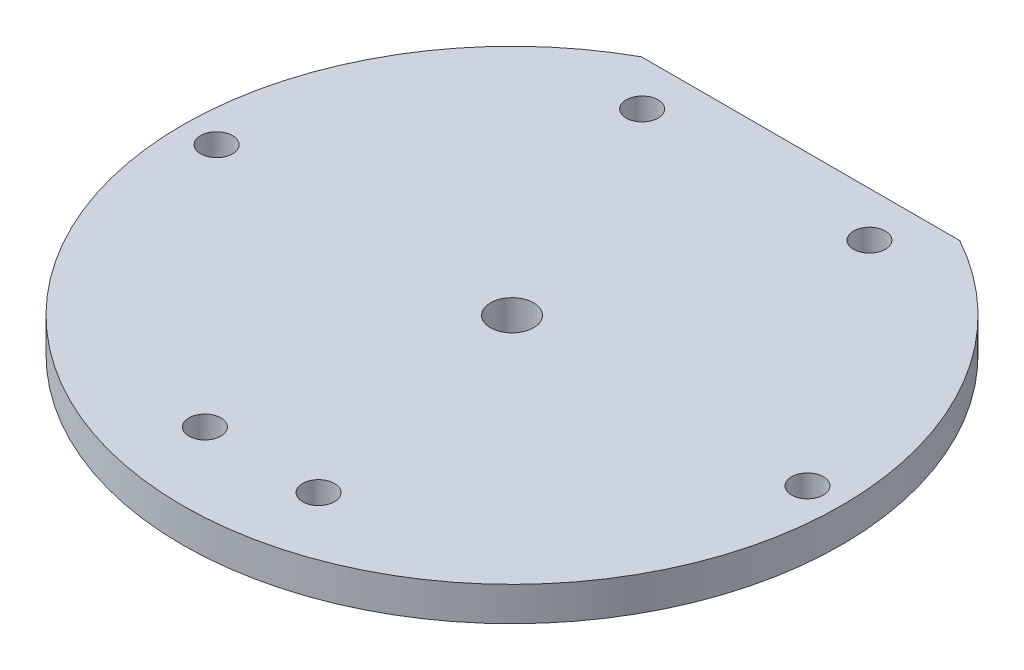
from build123d import *

# Parameters (mm, degrees)
SKETCH1_R           = 29
BOSS_EXTRUDE1_DEPTH = 3
SKETCH3_R           = 4
BOSS_EXTRUDE2_DEPTH = 4
SKETCH2_R           = 1.9
CUT_EXTRUDE1_DEPTH  = 42.605288125
SKETCH6_R           = 1.4
CUT_EXTRUDE3_DEPTH  = 10
SKETCH7_R           = 1.4
CUT_EXTRUDE4_DEPTH  = 10
CUT_EXTRUDE5_START  = -10
CUT_EXTRUDE5_DEPTH  = 10
SKETCH4_R           = 1.4
CUT_EXTRUDE7_DEPTH  = 10


with BuildPart() as part:
    # Sketch1 → Boss-Extrude1 (new body)
    with BuildSketch(Plane(origin=(0, 0, 0), x_dir=(1, 0, 0), z_dir=(0, 1, 0))):
        Circle(SKETCH1_R)
    extrude(amount=BOSS_EXTRUDE1_DEPTH)

    # Sketch3 → Boss-Extrude2 (add)
    with BuildSketch(Plane.XZ):
        Circle(SKETCH3_R)
    extrude(amount=BOSS_EXTRUDE2_DEPTH)

    # Sketch2 → Cut-Extrude1 (cut, through all)
    with BuildSketch(Plane(origin=(0, 3, 0), x_dir=(1, 0, 0), z_dir=(0, 1, 0))):
        Circle(SKETCH2_R)
    extrude(amount=-CUT_EXTRUDE1_DEPTH, mode=Mode.SUBTRACT)

    # Sketch6 → Cut-Extrude3 (cut)
    with BuildSketch(Plane(origin=(0, 3, 0), x_dir=(1, 0, 0), z_dir=(0, 1, 0))):
        with Locations((26, 0)):
            Circle(SKETCH6_R)
        with Locations((-26, 0)):
            Circle(SKETCH6_R)
    extrude(amount=-CUT_EXTRUDE3_DEPTH, mode=Mode.SUBTRACT)

    # Sketch7 → Cut-Extrude4 (cut)
    with BuildSketch(Plane(origin=(0, 3, 0), x_dir=(1, 0, 0), z_dir=(0, 1, 0))):
        with Locations((-10, 21.451657064)):
            Circle(SKETCH7_R)
        with Locations((10, 21.451657064)):
            Circle(SKETCH7_R)
    extrude(amount=-CUT_EXTRUDE4_DEPTH, mode=Mode.SUBTRACT)

    # Sketch7<3> → Cut-Extrude5 (cut)
    with BuildSketch(Plane(origin=(0, 3, 0), x_dir=(1, 0, 0), z_dir=(0, 1, 0)).offset(CUT_EXTRUDE5_START)):
        with BuildLine():
            Line((-14, 25.396850198), (14, 25.396850198))
            ThreePointArc((14, 25.396850198), (0, 29), (-14, 25.396850198))
        make_face()
    extrude(amount=CUT_EXTRUDE5_DEPTH, mode=Mode.SUBTRACT)

    # Sketch4 → Cut-Extrude7 (cut)
    with BuildSketch(Plane(origin=(0, 3, 0), x_dir=(1, 0, 0), z_dir=(0, 1, 0))):
        with Locations((-5, -22.025954195)):
            Circle(SKETCH4_R)
        with Locations((5, -22.025954195)):
            Circle(SKETCH4_R)
    extrude(amount=-CUT_EXTRUDE7_DEPTH, mode=Mode.SUBTRACT)


solid = part.part
